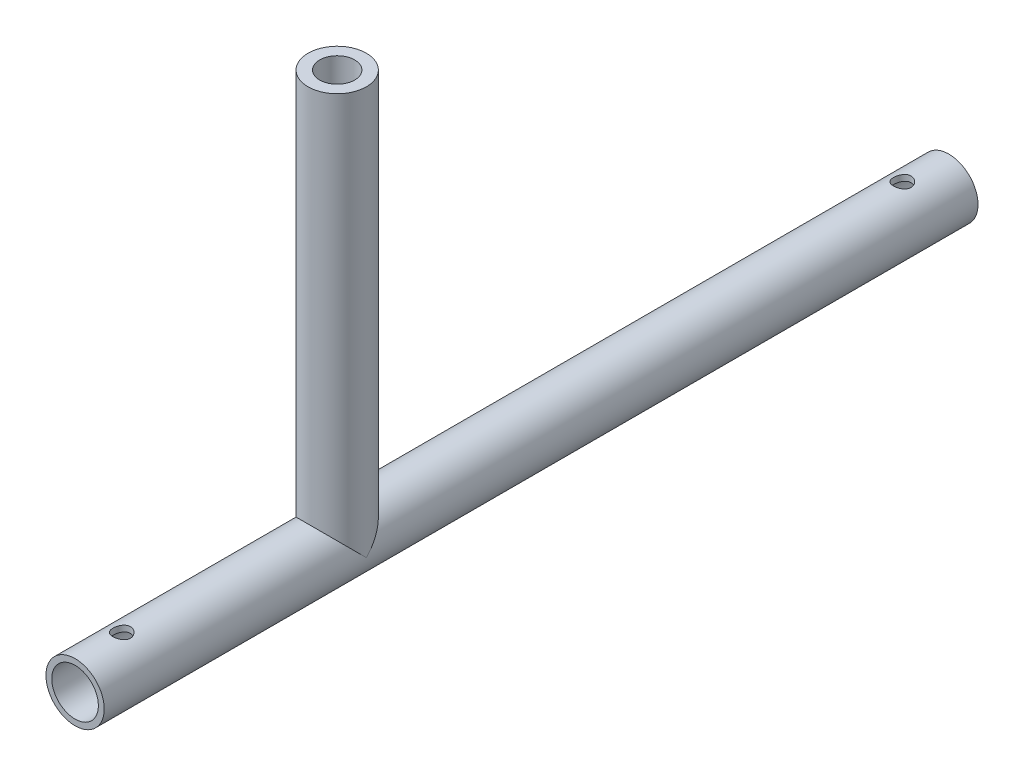
from build123d import *

# Parameters (mm, degrees)
SKETCH1_R                            = 5
SKETCH1_R_2                          = 4
BOSS_EXTRUDE1_DEPTH                  = 150
CUT_EXTRUDE1_DEPTH                   = 21
CUT_EXTRUDE1_DEPTH_BACK              = 21
SKETCH2_R                            = 1.5
BOSS_EXTRUDE2_START                  = 10
SKETCH3_R                            = 5
BOSS_EXTRUDE2_DEPTH                  = 60
BOSS_EXTRUDE2_DIRECTION_2_REACH      = 162.167
BOSS_EXTRUDE2_DIRECTION_2_END_RADIUS = 5
SKETCH4_R                            = 3
CUT_EXTRUDE2_DEPTH                   = 20


with BuildPart() as part:
    # Sketch1 → Boss-Extrude1 (new body)
    with BuildSketch(Plane.XY):
        Circle(SKETCH1_R)
        Circle(SKETCH1_R_2, mode=Mode.SUBTRACT)
    extrude(amount=BOSS_EXTRUDE1_DEPTH)

    # Sketch2 → Cut-Extrude1 (cut, two sides: drawn at the far end of the back side and taken through both)
    with BuildSketch(Plane(origin=(0, 0, 0), x_dir=(1, 0, 0), z_dir=(0, 1, 0)).offset(-CUT_EXTRUDE1_DEPTH_BACK)):
        with Locations((0, -142)):
            Circle(SKETCH2_R)
        with Locations((0, -8)):
            Circle(SKETCH2_R)
    extrude(amount=CUT_EXTRUDE1_DEPTH + CUT_EXTRUDE1_DEPTH_BACK, mode=Mode.SUBTRACT)

    # Sketch3 → Boss-Extrude2 (add)
    with BuildSketch(Plane(origin=(0, 0, 0), x_dir=(1, 0, 0), z_dir=(0, 1, 0)).offset(BOSS_EXTRUDE2_START)):
        with Locations((0, -105)):
            Circle(SKETCH3_R)
    extrude(amount=BOSS_EXTRUDE2_DEPTH)

    # Boss-Extrude2 direction 2: up to this cylinder (the profile starts outside it)
    boss_extrude2_direction_2_end = Plane(origin=(0, 0, 105), z_dir=(0, 0, -1)) * Cylinder(BOSS_EXTRUDE2_DIRECTION_2_END_RADIUS, 335.334, mode=Mode.PRIVATE)
    # Sketch3 → Boss-Extrude2 direction 2 (add, up to the surface)
    with BuildSketch(Plane(origin=(0, 0, 0), x_dir=(1, 0, 0), z_dir=(0, 1, 0)).offset(BOSS_EXTRUDE2_START), mode=Mode.PRIVATE) as boss_extrude2_direction_2_sk1:
        with Locations((0, -105)):
            Circle(SKETCH3_R)
    boss_extrude2_direction_2_tool1 = extrude(boss_extrude2_direction_2_sk1.sketch, amount=-BOSS_EXTRUDE2_DIRECTION_2_REACH, mode=Mode.PRIVATE) - boss_extrude2_direction_2_end
    add(boss_extrude2_direction_2_tool1.solids().sort_by_distance((0, 10, 105))[0])

    # Sketch4 → Cut-Extrude2 (cut)
    with BuildSketch(Plane(origin=(0, 70, 0), x_dir=(1, 0, 0), z_dir=(0, 1, 0))):
        with Locations((0, -105)):
            Circle(SKETCH4_R)
    extrude(amount=-CUT_EXTRUDE2_DEPTH, mode=Mode.SUBTRACT)


solid = part.part
